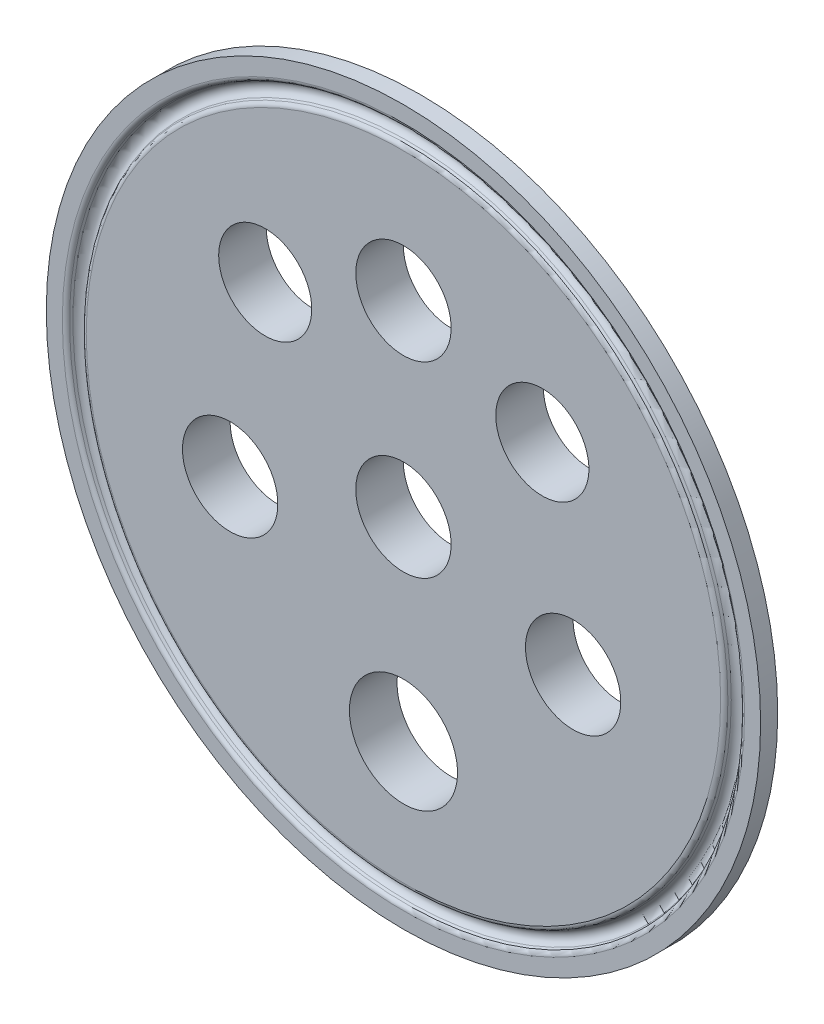
from build123d import *

# Parameters (mm, degrees)
SKETCH2_R          = 7.75
SKETCH2_R_2        = 7.9375
SKETCH2_R_3        = 9
CUT_EXTRUDE1_DEPTH = 85.463711951


with BuildPart() as part:
    # Sketch1 → Revolve1 (revolve)
    with BuildSketch(Plane(origin=(0, 0, 0), x_dir=(0, 0, -1), z_dir=(1, 0, 0)), mode=Mode.PRIVATE) as revolve1_sk:
        with BuildLine():
            Line((0, 0), (0, 52.809927725))
            ThreePointArc((0, 52.809927725), (0.130798304, 53.244522907), (0.479738309, 53.534733247))
            Line((0.479738309, 53.534733247), (0.872854821, 53.701601306))
            ThreePointArc((0.872854821, 53.701601306), (1.6002, 54.8005), (0.872854821, 55.899398694))
            Line((0.872854821, 55.899398694), (0.479738309, 56.066266753))
            ThreePointArc((0.479738309, 56.066266753), (0.130798304, 56.356477093), (0, 56.791072275))
            Line((0, 56.791072275), (0, 59.4614))
            Line((0, 59.4614), (2.8448, 59.4614))
            Line((2.8448, 59.4614), (7.9248, 45.504214709))
            Line((7.9248, 45.504214709), (7.9248, 0))
            Line((7.9248, 0), (0, 0))
        make_face()
    revolve(revolve1_sk.sketch.rotate(Axis((0, 0, 0), (0, 0, -1)), 90), axis=Axis((0, 0, 0), (0, 0, -1)))

    # Sketch2 → Cut-Extrude1 (cut, through all)
    with BuildSketch(Plane(origin=(0, 0, -7.9248), x_dir=(-1, 0, 0), z_dir=(0, 0, -1))):
        with Locations((-23.121403313, 22.329574432)):
            Circle(SKETCH2_R)
        with Locations((23.014902328, 22.329574432)):
            Circle(SKETCH2_R)
        with Locations((0, 31.198057894)):
            Circle(SKETCH2_R_2)
        Circle(SKETCH2_R_2)
        with Locations((-28.2480994, -8.614227209)):
            Circle(SKETCH2_R_2)
        with Locations((0, -32.377727799)):
            Circle(SKETCH2_R_3)
        with Locations((28.850997909, -8.614227209)):
            Circle(SKETCH2_R_2)
    extrude(amount=-CUT_EXTRUDE1_DEPTH, mode=Mode.SUBTRACT)


solid = part.part
